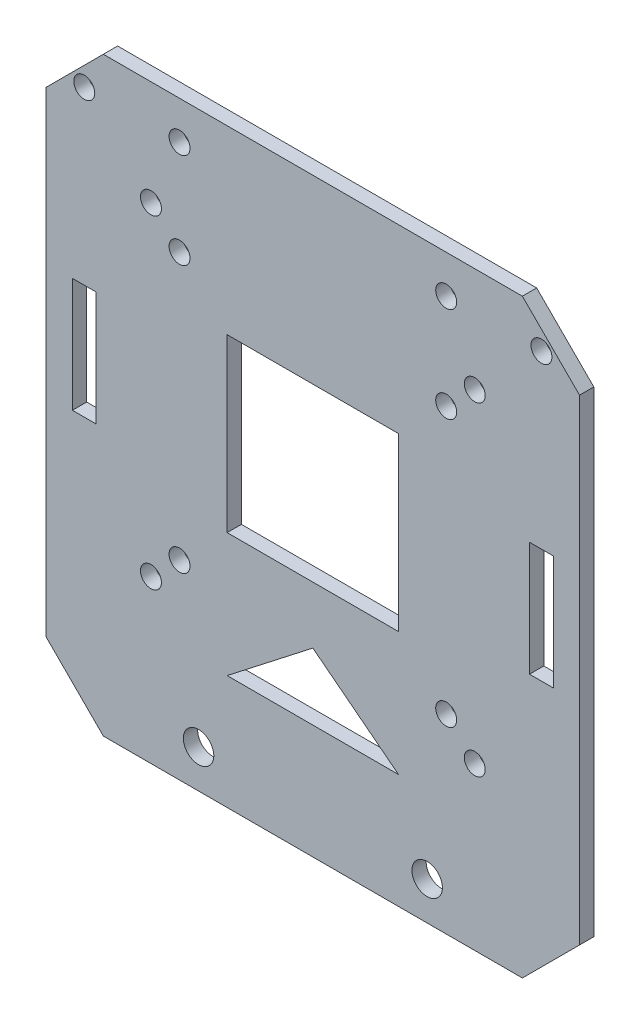
from build123d import *

# Parameters (mm, degrees)
SKETCH_1_R        = 1.6
SKETCH_1_R_2      = 1.1
SKETCH_1_W        = 2.5
SKETCH_1_H        = 12
SKETCH_1_W_2      = 18
SKETCH_1_H_2      = 18
EXTRUDE_284_DEPTH = 1.5
SKETCH_2_R        = 1.1
D2P2_DEPTH        = 1.5


with BuildPart() as part:
    # 草图1 → Extrude 284 (new body)
    with BuildSketch(Plane.XY):
        Polygon((-22, 4), (22, 4), (28, 10), (28, 60), (22, 66), (-22, 66), (-28, 60), (-28, 10), align=None)
        with Locations((-12, 8)):
            Circle(SKETCH_1_R, mode=Mode.SUBTRACT)
        with Locations((-24, 62)):
            Circle(SKETCH_1_R_2, mode=Mode.SUBTRACT)
        with Locations((12, 8)):
            Circle(SKETCH_1_R, mode=Mode.SUBTRACT)
        with Locations((24, 62)):
            Circle(SKETCH_1_R_2, mode=Mode.SUBTRACT)
        with Locations((-14, 24)):
            Circle(SKETCH_1_R_2, mode=Mode.SUBTRACT)
        with Locations((-14, 52)):
            Circle(SKETCH_1_R_2, mode=Mode.SUBTRACT)
        with Locations((14, 24)):
            Circle(SKETCH_1_R_2, mode=Mode.SUBTRACT)
        with Locations((14, 52)):
            Circle(SKETCH_1_R_2, mode=Mode.SUBTRACT)
        with Locations((-17, 21)):
            Circle(SKETCH_1_R_2, mode=Mode.SUBTRACT)
        with Locations((-17, 55)):
            Circle(SKETCH_1_R_2, mode=Mode.SUBTRACT)
        with Locations((17, 21)):
            Circle(SKETCH_1_R_2, mode=Mode.SUBTRACT)
        with Locations((17, 55)):
            Circle(SKETCH_1_R_2, mode=Mode.SUBTRACT)
        with Locations((-24, 38)):
            Rectangle(SKETCH_1_W, SKETCH_1_H, mode=Mode.SUBTRACT)
        with Locations((24, 38)):
            Rectangle(SKETCH_1_W, SKETCH_1_H, mode=Mode.SUBTRACT)
        with Locations((0, 38)):
            Rectangle(SKETCH_1_W_2, SKETCH_1_H_2, mode=Mode.SUBTRACT)
        Polygon((-9, 16), (9, 16), (0, 23), align=None, mode=Mode.SUBTRACT)
    extrude(amount=EXTRUDE_284_DEPTH)

    # 草图2 → 外拉钢索两孔_D2p2 (cut)
    with BuildSketch(Plane.XY):
        with Locations((-14, 62)):
            Circle(SKETCH_2_R)
        with Locations((14, 62)):
            Circle(SKETCH_2_R)
    extrude(amount=D2P2_DEPTH, mode=Mode.SUBTRACT)


solid = part.part
